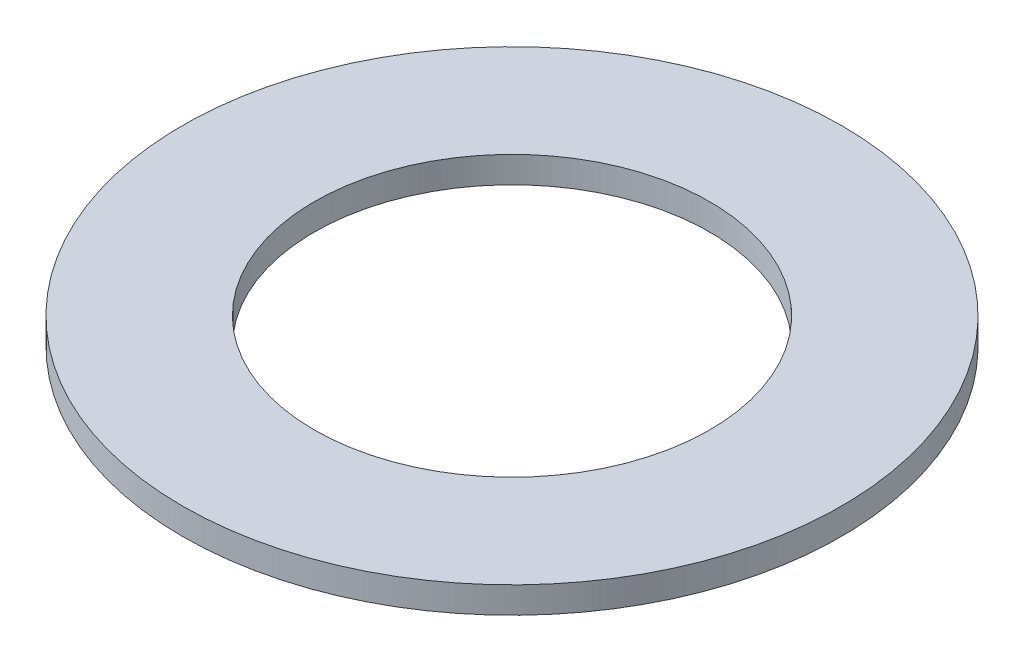
from build123d import *

# Parameters (mm, degrees)
SKETCH_3_R      = 2.5
SKETCH_3_R_2    = 1.5
EXTRUDE_1_DEPTH = 0.1


with BuildPart() as part:
    # 草图3 → 凸台-拉伸1 (new, symmetric)
    with BuildSketch(Plane(origin=(0, 0, 0), x_dir=(1, 0, 0), z_dir=(0, 1, 0))):
        with Locations(Location((0, 0, 0), (0, 0, 270))):
            Circle(SKETCH_3_R)
        with Locations(Location((0, 0, 0), (0, 0, 270))):
            Circle(SKETCH_3_R_2, mode=Mode.SUBTRACT)
    extrude(amount=EXTRUDE_1_DEPTH, both=True)


solid = part.part
